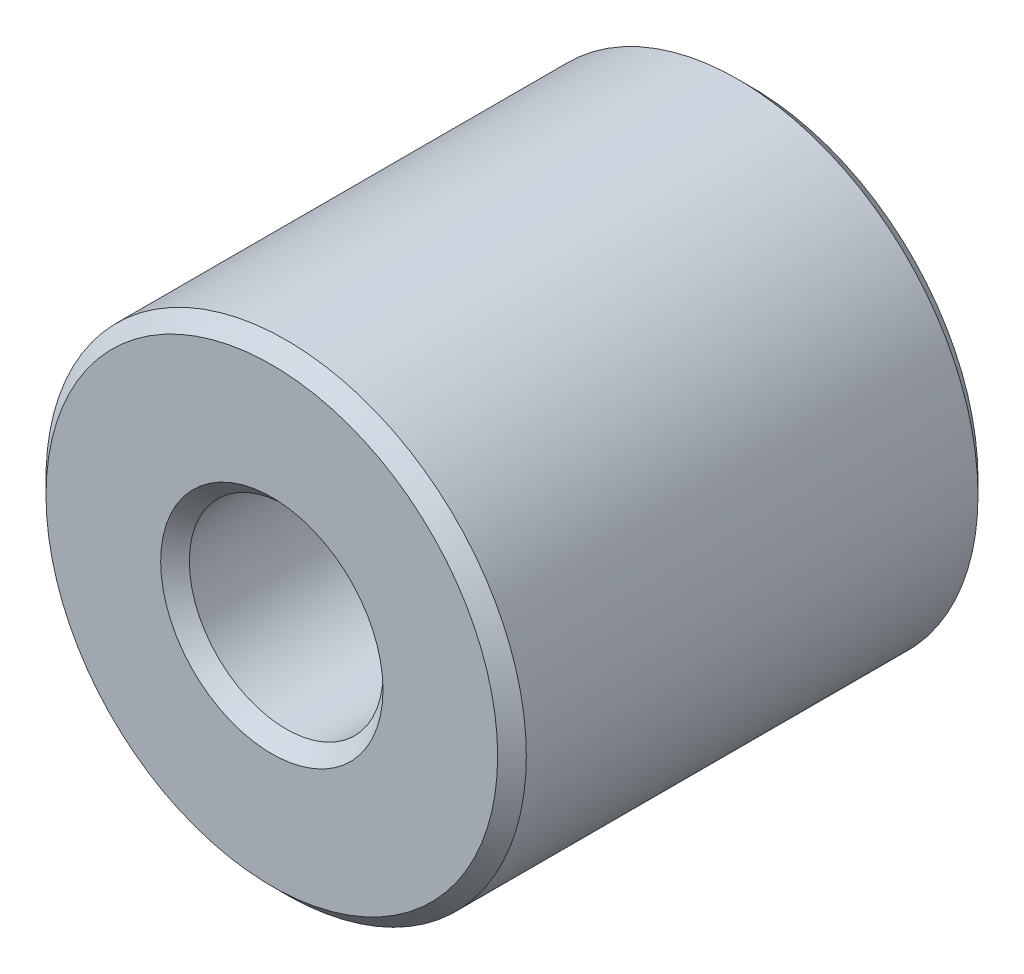
from build123d import *

# Parameters (mm, degrees)
BOSS_EXTRUDE1_DEPTH      = 7.9375
BOSS_EXTRUDE1_DEPTH_BACK = 7.9375
SKETCH3_R                = 7.9375
SKETCH3_R_2              = 3.2004
CHAMFER1_SIZE            = 0.47371


with BuildPart() as part:
    # Sketch3 → Boss-Extrude1 (new, two sides: drawn at the far end of the back side and taken through both)
    with BuildSketch(Plane.XY.offset(-BOSS_EXTRUDE1_DEPTH_BACK)):
        Circle(SKETCH3_R)
        Circle(SKETCH3_R_2, mode=Mode.SUBTRACT)
    extrude(amount=BOSS_EXTRUDE1_DEPTH + BOSS_EXTRUDE1_DEPTH_BACK)

    # Chamfer1
    chamfer1_edges = [part.edges().sort_by_distance(p)[0] for p in [
        (-7.9375, 0, -7.9375),
        (-3.2004, 0, -7.9375),
        (-7.9375, 0, 7.9375),
        (-3.2004, 0, 7.9375),
    ]]
    chamfer(chamfer1_edges, length=CHAMFER1_SIZE)


solid = part.part
